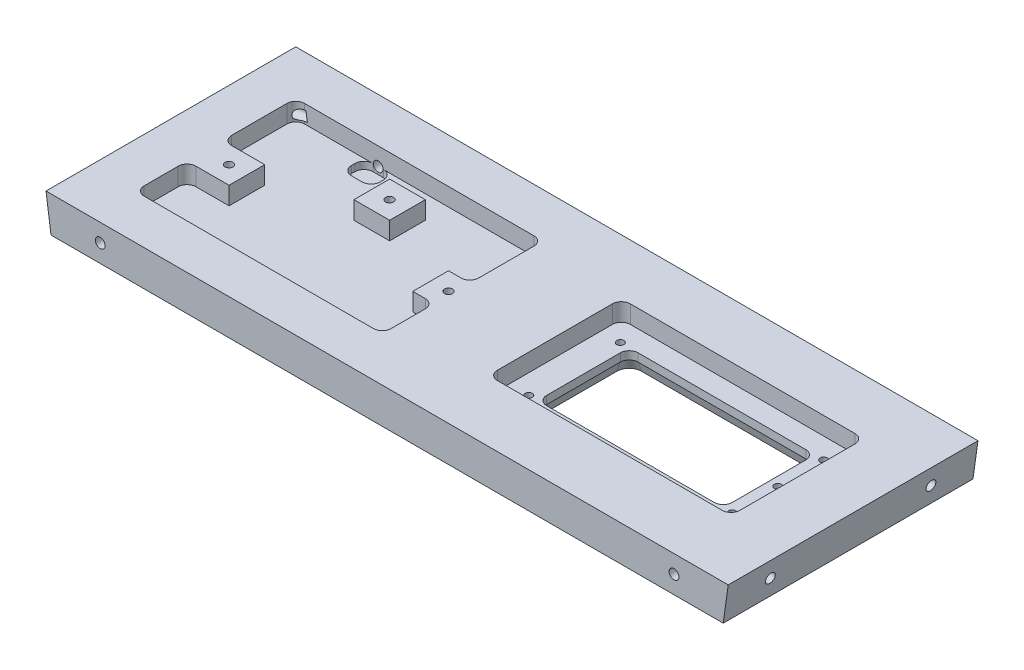
from build123d import *

# Parameters (mm, degrees)
BOSS_EXTRUDE1_DEPTH = 140
CUT_EXTRUDE1_DEPTH  = 10
SKETCH3_R           = 2
CUT_EXTRUDE2_DEPTH  = 10
CUT_EXTRUDE3_DEPTH  = 238.196618491
CHAMFER2_SIZE       = 2
CHAMFER2_SIZE2      = 5.494954839
SKETCH5_R           = 3.5
CUT_EXTRUDE4_DEPTH  = 4
SKETCH6_R           = 2.25
CUT_EXTRUDE5_DEPTH  = 238.828164555
SKETCH7_R           = 3.5
CUT_EXTRUDE6_DEPTH  = 10
SKETCH9_R           = 2.75
CUT_EXTRUDE8_DEPTH  = 30
SKETCH11_R          = 2.75
CUT_EXTRUDE9_DEPTH  = 30
SKETCH12_R          = 2.75
CUT_EXTRUDE10_DEPTH = 30
SKETCH13_W          = 20
SKETCH13_H          = 20
CUT_EXTRUDE11_DEPTH = 10
CUT_EXTRUDE12_DEPTH = 4
CUT_EXTRUDE13_DEPTH = 4


with BuildPart() as part:
    # Sketch1 → Boss-Extrude1 (new body)
    with BuildSketch(Plane.XY):
        Polygon((188.401724275, -20), (-188.401724275, -20), (-191.212540969, 0), (191.212540969, 0), align=None)
    extrude(amount=BOSS_EXTRUDE1_DEPTH)

    # Sketch2 → Cut-Extrude1 (cut)
    with BuildSketch(Plane(origin=(0, 0, 0), x_dir=(1, 0, 0), z_dir=(0, 1, 0))):
        with BuildLine():
            Line((153.3, -105.5), (27.3, -105.5))
            ThreePointArc((27.3, -105.5), (23.764466094, -104.035533906), (22.3, -100.5))
            Line((22.3, -100.5), (22.3, -36))
            ThreePointArc((22.3, -36), (23.764466094, -32.464466094), (27.3, -31))
            Line((27.3, -31), (153.3, -31))
            ThreePointArc((153.3, -31), (156.835533906, -32.464466094), (158.3, -36))
            Line((158.3, -36), (158.3, -100.5))
            ThreePointArc((158.3, -100.5), (156.835533906, -104.035533906), (153.3, -105.5))
        make_face()
    extrude(amount=-CUT_EXTRUDE1_DEPTH, mode=Mode.SUBTRACT)

    # Sketch3 → Cut-Extrude2 (cut)
    with BuildSketch(Plane(origin=(0, -10, 0), x_dir=(1, 0, 0), z_dir=(0, 1, 0))):
        with Locations(Location((147.3, -42.6, 0), (0, 0, 270))):
            Circle(SKETCH3_R)
        with Locations(Location((147.3, -68.25, 0), (0, 0, 270))):
            Circle(SKETCH3_R)
        with Locations(Location((147.3, -93.9, 0), (0, 0, 270))):
            Circle(SKETCH3_R)
        with Locations(Location((33.3, -93.9, 0), (0, 0, 270))):
            Circle(SKETCH3_R)
        with Locations(Location((33.3, -42.6, 0), (0, 0, 270))):
            Circle(SKETCH3_R)
    extrude(amount=-CUT_EXTRUDE2_DEPTH, mode=Mode.SUBTRACT)

    # Sketch4 → Cut-Extrude3 (cut, through all)
    with BuildSketch(Plane(origin=(0, -10, 0), x_dir=(1, 0, 0), z_dir=(0, 1, 0))):
        with BuildLine():
            Line((137.3, -93.9), (43.3, -93.9))
            ThreePointArc((43.3, -93.9), (39.764466094, -92.435533906), (38.3, -88.9))
            Line((38.3, -88.9), (38.3, -47.6))
            ThreePointArc((38.3, -47.6), (39.764466094, -44.064466094), (43.3, -42.6))
            Line((43.3, -42.6), (137.3, -42.6))
            ThreePointArc((137.3, -42.6), (140.835533906, -44.064466094), (142.3, -47.6))
            Line((142.3, -47.6), (142.3, -88.9))
            ThreePointArc((142.3, -88.9), (140.835533906, -92.435533906), (137.3, -93.9))
        make_face()
    extrude(amount=-CUT_EXTRUDE3_DEPTH, mode=Mode.SUBTRACT)

    # Chamfer2
    chamfer2_edges = [part.edges().sort_by_distance(p)[0] for p in [
        (140.835533906, -20, 44.064466094),
        (142.3, -20, 68.25),
        (140.835533906, -20, 92.435533906),
        (90.3, -20, 93.9),
        (39.764466094, -20, 92.435533906),
        (38.3, -20, 68.25),
        (39.764466094, -20, 44.064466094),
        (90.3, -20, 42.6),
    ]]
    chamfer2_side = [part.faces().sort_by_distance(p)[0] for p in [
        (-10.263036495, -20, 70.198603049),
    ]]
    chamfer(chamfer2_edges, length=CHAMFER2_SIZE, length2=CHAMFER2_SIZE2, reference=chamfer2_side[0])

    # Sketch5 → Cut-Extrude4 (cut)
    with BuildSketch(Plane.XZ.offset(20)):
        with Locations(Location((147.3, 42.6, 0), (0, 0, 270))):
            Circle(SKETCH5_R)
        with Locations(Location((147.3, 68.25, 0), (0, 0, 270))):
            Circle(SKETCH5_R)
        with Locations(Location((147.3, 93.9, 0), (0, 0, 270))):
            Circle(SKETCH5_R)
        with Locations(Location((33.3, 93.9, 0), (0, 0, 270))):
            Circle(SKETCH5_R)
        with Locations(Location((33.3, 42.6, 0), (0, 0, 270))):
            Circle(SKETCH5_R)
    extrude(amount=-CUT_EXTRUDE4_DEPTH, mode=Mode.SUBTRACT)

    # Sketch6 → Cut-Extrude5 (cut, through all)
    with BuildSketch(Plane(origin=(0, 0, 0), x_dir=(1, 0, 0), z_dir=(0, 1, 0))):
        with Locations(Location((-29.7, -75.9, 0), (0, 0, 270))):
            Circle(SKETCH6_R)
        with Locations(Location((-90.7, -47.9, 0), (0, 0, 270))):
            Circle(SKETCH6_R)
        with Locations(Location((-152.7, -75.9, 0), (0, 0, 270))):
            Circle(SKETCH6_R)
    extrude(amount=-CUT_EXTRUDE5_DEPTH, mode=Mode.SUBTRACT)

    # Sketch7 → Cut-Extrude6 (cut)
    with BuildSketch(Plane.XZ.offset(20)):
        with Locations(Location((-29.7, 75.9, 0), (0, 0, 270))):
            Circle(SKETCH7_R)
        with Locations(Location((-90.7, 47.9, 0), (0, 0, 270))):
            Circle(SKETCH7_R)
        with Locations(Location((-152.7, 75.9, 0), (0, 0, 270))):
            Circle(SKETCH7_R)
    extrude(amount=-CUT_EXTRUDE6_DEPTH, mode=Mode.SUBTRACT)

    # Sketch9 → Cut-Extrude8 (cut)
    with BuildSketch(Plane(origin=(-187.508916193, -26.352659596, 0), x_dir=(0, 0, 1), z_dir=(-0.9902680687415703, -0.13917310096006588, 0))):
        with Locations(Location((25, 16.515090819, 0), (0, 0, 270))):
            Circle(SKETCH9_R)
        with Locations(Location((115, 16.515090819, 0), (0, 0, 90))):
            Circle(SKETCH9_R)
    cut_extrude8 = extrude(amount=-CUT_EXTRUDE8_DEPTH, mode=Mode.SUBTRACT)

    # Mirror1: Cut-Extrude8 across plane
    add(cut_extrude8.mirror(Plane(origin=(0, 0, 0), x_dir=(0, 0, 1), z_dir=(1, 0, 0))), mode=Mode.SUBTRACT)

    # Sketch11 → Cut-Extrude9 (cut)
    with BuildSketch(Plane.XY.offset(140)):
        with Locations((-160.802791245, -10)):
            Circle(SKETCH11_R)
        with Locations(Location((160.802791245, -10, 0), (0, 0, 180))):
            Circle(SKETCH11_R)
    extrude(amount=-CUT_EXTRUDE9_DEPTH, mode=Mode.SUBTRACT)

    # Sketch12 → Cut-Extrude10 (cut)
    with BuildSketch(Plane(origin=(0, 0, 0), x_dir=(-1, 0, 0), z_dir=(0, 0, -1))):
        with Locations((120, -10)):
            Circle(SKETCH12_R)
        with Locations((-120, -10)):
            Circle(SKETCH12_R)
    extrude(amount=-CUT_EXTRUDE10_DEPTH, mode=Mode.SUBTRACT)

    # Sketch13 → Cut-Extrude11 (cut)
    with BuildSketch(Plane(origin=(0, 0, 0), x_dir=(1, 0, 0), z_dir=(0, 1, 0))):
        with BuildLine():
            Line((-32.7, -115), (-161.212540969, -115))
            ThreePointArc((-161.212540969, -115), (-164.748074875, -113.535533906), (-166.212540969, -110))
            Line((-166.212540969, -110), (-166.212540969, -90.9))
            ThreePointArc((-166.212540969, -90.9), (-164.748074875, -87.364466094), (-161.212540969, -85.9))
            Line((-161.212540969, -85.9), (-142.7, -85.9))
            Line((-142.7, -85.9), (-142.7, -65.9))
            Line((-142.7, -65.9), (-161.212540969, -65.9))
            ThreePointArc((-161.212540969, -65.9), (-164.748074875, -64.435533906), (-166.212540969, -60.9))
            Line((-166.212540969, -60.9), (-166.212540969, -30))
            ThreePointArc((-166.212540969, -30), (-164.748074875, -26.464466094), (-161.212540969, -25))
            Line((-161.212540969, -25), (-32.7, -25))
            ThreePointArc((-32.7, -25), (-29.164466094, -26.464466094), (-27.7, -30))
            Line((-27.7, -30), (-27.7, -60.9))
            ThreePointArc((-27.7, -60.9), (-29.164466094, -64.435533906), (-32.7, -65.9))
            Line((-32.7, -65.9), (-39.7, -65.9))
            Line((-39.7, -65.9), (-39.7, -85.9))
            Line((-39.7, -85.9), (-32.7, -85.9))
            ThreePointArc((-32.7, -85.9), (-29.164466094, -87.364466094), (-27.7, -90.9))
            Line((-27.7, -90.9), (-27.7, -110))
            ThreePointArc((-27.7, -110), (-29.164466094, -113.535533906), (-32.7, -115))
        make_face()
        with Locations((-90.7, -47.9)):
            Rectangle(SKETCH13_W, SKETCH13_H, mode=Mode.SUBTRACT)
    extrude(amount=-CUT_EXTRUDE11_DEPTH, mode=Mode.SUBTRACT)

    # Sketch14 → Cut-Extrude12 (cut)
    with BuildSketch(Plane(origin=(0, -10, 0), x_dir=(1, 0, 0), z_dir=(0, 1, 0))):
        with BuildLine():
            Line((-117, -37), (-123, -37))
            ThreePointArc((-123, -37), (-126.535533906, -35.535533906), (-128, -32))
            Line((-128, -32), (-128, -30))
            ThreePointArc((-128, -30), (-126.535533906, -26.464466094), (-123, -25))
            Line((-123, -25), (-117, -25))
            ThreePointArc((-117, -25), (-113.464466094, -26.464466094), (-112, -30))
            Line((-112, -30), (-112, -32))
            ThreePointArc((-112, -32), (-113.464466094, -35.535533906), (-117, -37))
        make_face()
        with BuildLine():
            Line((-157.912540969, -105), (-161.212540969, -105))
            ThreePointArc((-161.212540969, -105), (-166.212540969, -110), (-161.212540969, -115))
            Line((-161.212540969, -115), (-157.912540969, -115))
            ThreePointArc((-157.912540969, -115), (-152.912540969, -110), (-157.912540969, -105))
        make_face()
    extrude(amount=-CUT_EXTRUDE12_DEPTH, mode=Mode.SUBTRACT)

    # Sketch15 → Cut-Extrude13 (cut)
    with BuildSketch(Plane.XZ.offset(20)):
        with BuildLine():
            Line((147.3, 71.75), (142.3, 71.75))
            Line((142.3, 71.75), (142.3, 64.75))
            Line((142.3, 64.75), (147.3, 64.75))
            ThreePointArc((147.3, 64.75), (150.8, 68.25), (147.3, 71.75))
        make_face()
    extrude(amount=-CUT_EXTRUDE13_DEPTH, mode=Mode.SUBTRACT)


solid = part.part
